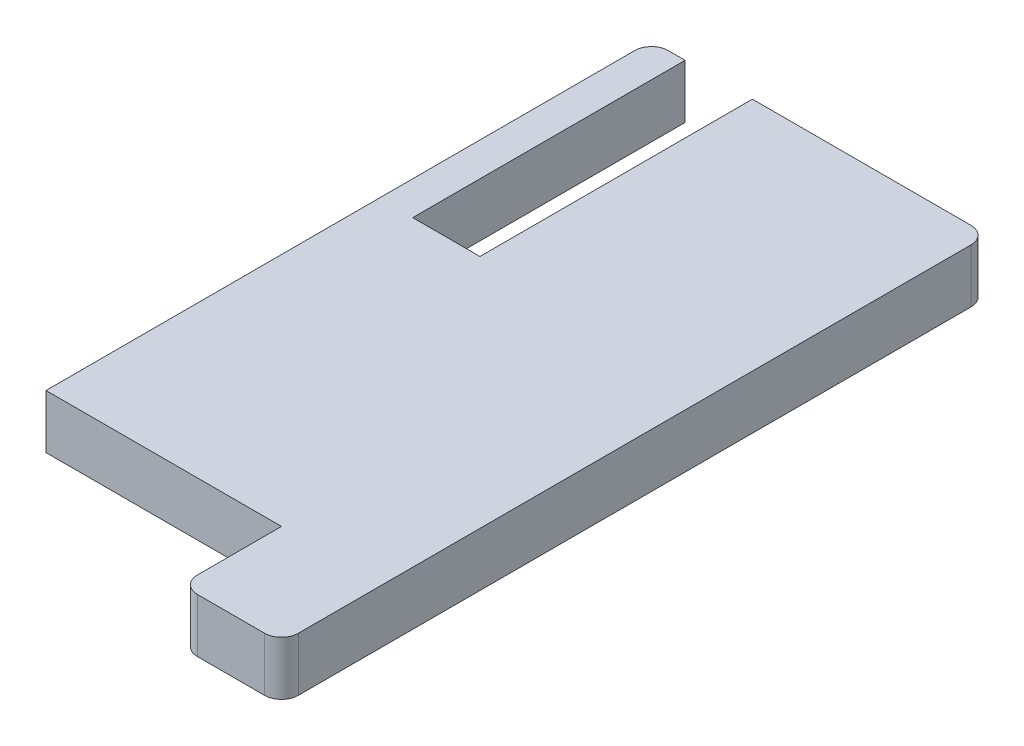
from build123d import *

# Parameters (mm, degrees)
BOSS_EXTRUDE1_DEPTH = 1.6


with BuildPart() as part:
    # Sketch1 → Boss-Extrude1 (new body)
    with BuildSketch(Plane(origin=(0, 0, 0), x_dir=(1, 0, 0), z_dir=(0, 1, 0))):
        with BuildLine():
            Line((623.01202177, -61.448413556), (625.01202177, -61.448413556))
            ThreePointArc((625.01202177, -61.448413556), (625.36557516, -61.301966947), (625.51202177, -60.948413556))
            Line((625.51202177, -60.948413556), (625.51202177, -40.948413556))
            ThreePointArc((625.51202177, -40.948413556), (625.36557516, -40.594860166), (625.01202177, -40.448413556))
            Line((625.01202177, -40.448413556), (618.76202177, -40.448413556))
            Line((618.76202177, -40.448413556), (618.51202177, -40.448413556))
            Line((618.51202177, -40.448413556), (618.51202177, -48.548413556))
            Line((618.51202177, -48.548413556), (616.51202177, -48.548413556))
            Line((616.51202177, -48.548413556), (616.51202177, -40.448413556))
            Line((616.51202177, -40.448413556), (616.26202177, -40.448413556))
            Line((616.26202177, -40.448413556), (616.01202177, -40.448413556))
            ThreePointArc((616.01202177, -40.448413556), (615.658468379, -40.594860166), (615.51202177, -40.948413556))
            Line((615.51202177, -40.948413556), (615.51202177, -58.448413556))
            Line((615.51202177, -58.448413556), (616.26202177, -58.448413556))
            Line((616.26202177, -58.448413556), (618.76202177, -58.448413556))
            Line((618.76202177, -58.448413556), (622.51202177, -58.448413556))
            Line((622.51202177, -58.448413556), (622.51202177, -60.948413556))
            ThreePointArc((622.51202177, -60.948413556), (622.658468379, -61.301966947), (623.01202177, -61.448413556))
        make_face()
    extrude(amount=BOSS_EXTRUDE1_DEPTH)


solid = part.part
